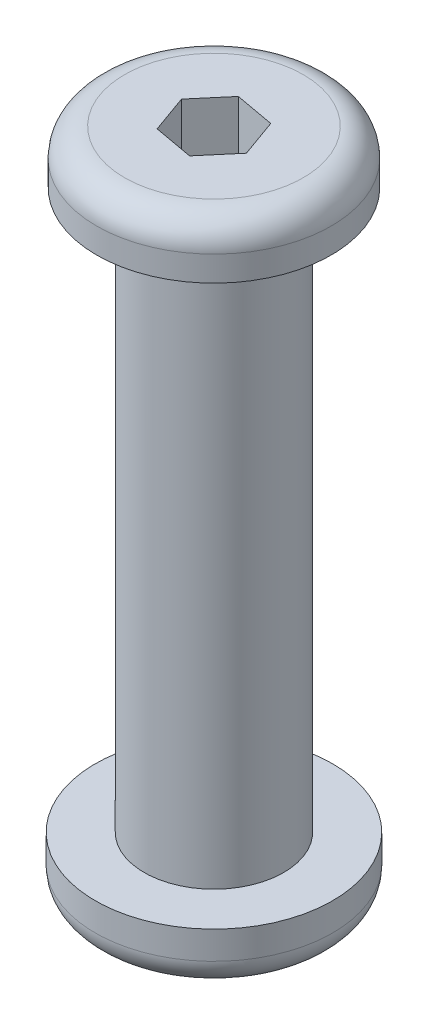
from build123d import *

# Parameters (mm, degrees)
SKETCH_1_R      = 2.5
EXTRUDE_1_DEPTH = 20
SKETCH_2_R      = 4.2
EXTRUDE_2_DEPTH = 1.9
SKETCH_3_R      = 4.25
EXTRUDE_3_DEPTH = 2
FILLET_1_R      = 1


with BuildPart() as part:
    # 草图1 → 凸台-拉伸1 (new body)
    with BuildSketch(Plane(origin=(0, 0, 0), x_dir=(1, 0, 0), z_dir=(0, 1, 0))):
        with Locations(Location((0, 0, 0), (0, 0, 270))):
            Circle(SKETCH_1_R)
    extrude(amount=EXTRUDE_1_DEPTH)

    # 草图2 → 凸台-拉伸2 (add)
    with BuildSketch(Plane(origin=(0, 20, 0), x_dir=(1, 0, 0), z_dir=(0, 1, 0))):
        with Locations(Location((0, 0, 0), (0, 0, 90))):
            Circle(SKETCH_2_R)
        Polygon((0.933529185, 1.100843583), (-0.486593916, 1.358881781), (-1.420123101, 0.258038198), (-0.933529185, -1.100843583), (0.486593916, -1.358881781), (1.420123101, -0.258038198), align=None, mode=Mode.SUBTRACT)
    extrude(amount=EXTRUDE_2_DEPTH)

    # 草图3 → 凸台-拉伸3 (add)
    with BuildSketch(Plane.XZ):
        with Locations(Location((0, 0, 0), (0, 0, 270))):
            Circle(SKETCH_3_R)
        Polygon((0.831789315, 1.179601572), (-0.605670271, 1.310151463), (-1.437459585, 0.130549891), (-0.831789315, -1.179601572), (0.605670271, -1.310151463), (1.437459585, -0.130549891), align=None, mode=Mode.SUBTRACT)
    extrude(amount=EXTRUDE_3_DEPTH)

    # 圆角1
    fillet_1_edges = [part.edges().sort_by_distance(p)[0] for p in [
        (0, 21.9, 4.2),
        (0, -2, 4.25),
    ]]
    fillet(fillet_1_edges, radius=FILLET_1_R)


solid = part.part
